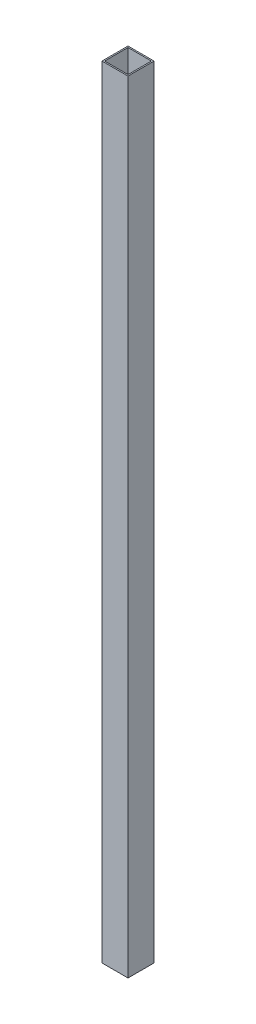
from build123d import *

# Parameters (mm, degrees)
SKETCH_1_W      = 20
SKETCH_1_H      = 20
SKETCH_1_W_2    = 18
SKETCH_1_H_2    = 18
EXTRUDE_1_DEPTH = 600


with BuildPart() as part:
    # 草图1 → 凸台-拉伸1 (new body)
    with BuildSketch(Plane(origin=(0, 0, 0), x_dir=(1, 0, 0), z_dir=(0, 1, 0))):
        Rectangle(SKETCH_1_W, SKETCH_1_H)
        Rectangle(SKETCH_1_W_2, SKETCH_1_H_2, mode=Mode.SUBTRACT)
    extrude(amount=EXTRUDE_1_DEPTH)


solid = part.part
